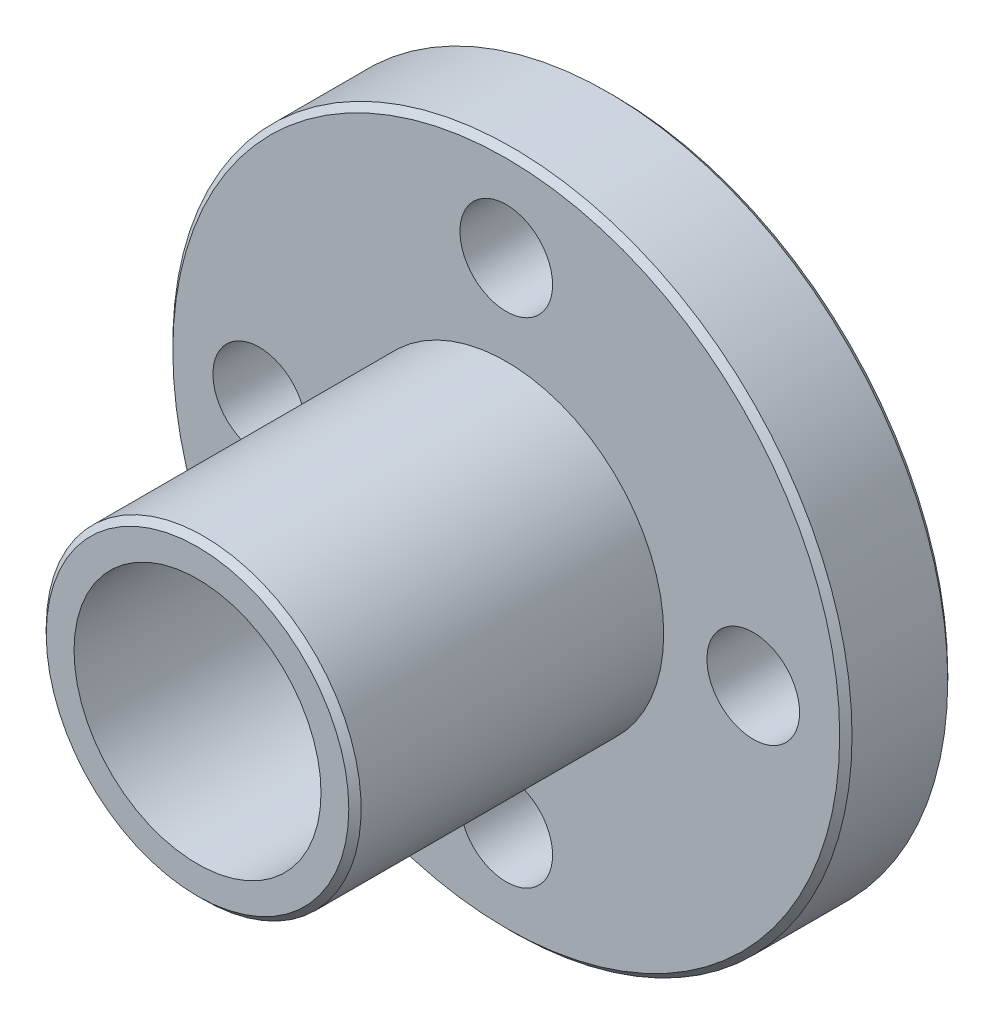
from build123d import *

# Parameters (mm, degrees)
SKETCH1_R               = 5.1
SKETCH1_R_2             = 4
BOSS_EXTRUDE1_DEPTH     = 1.5
SKETCH2_R               = 11
SKETCH2_R_2             = 4
BOSS_EXTRUDE2_DEPTH     = 3.5
SKETCH3_R               = 5.1
SKETCH3_R_2             = 4
BOSS_EXTRUDE3_DEPTH     = 15
CUT_EXTRUDE1_DEPTH      = 21.597329924
CUT_EXTRUDE1_DEPTH_BACK = 21.597329924
SKETCH4_R               = 1.5
CHAMFER1_SIZE           = 0.2


with BuildPart() as part:
    # Sketch1 → Boss-Extrude1 (new body)
    with BuildSketch(Plane.XY):
        Circle(SKETCH1_R)
        Circle(SKETCH1_R_2, mode=Mode.SUBTRACT)
    extrude(amount=BOSS_EXTRUDE1_DEPTH)

    # Sketch2 → Boss-Extrude2 (add)
    with BuildSketch(Plane.XY.offset(1.5)):
        Circle(SKETCH2_R)
        Circle(SKETCH2_R_2, mode=Mode.SUBTRACT)
    extrude(amount=BOSS_EXTRUDE2_DEPTH)

    # Sketch3 → Boss-Extrude3 (add)
    with BuildSketch(Plane(origin=(0, 0, 0), x_dir=(-1, 0, 0), z_dir=(0, 0, -1))):
        with Locations(Location((0, 0, 0), (0, 0, 180))):
            Circle(SKETCH3_R)
        Circle(SKETCH3_R_2, mode=Mode.SUBTRACT)
    extrude(amount=-BOSS_EXTRUDE3_DEPTH)

    # Sketch4 → Cut-Extrude1 (cut, two sides: drawn at the far end of the back side and taken through both)
    with BuildSketch(Plane(origin=(0, 0, 1.5), x_dir=(-1, 0, 0), z_dir=(0, 0, -1)).offset(-CUT_EXTRUDE1_DEPTH_BACK)):
        with Locations(Location((0, 8, 0), (0, 0, 180))):
            Circle(SKETCH4_R)
        with Locations(Location((8, 0, 0), (0, 0, 180))):
            Circle(SKETCH4_R)
        with Locations(Location((0, -8, 0), (0, 0, 180))):
            Circle(SKETCH4_R)
        with Locations(Location((-8, 0, 0), (0, 0, 180))):
            Circle(SKETCH4_R)
    extrude(amount=CUT_EXTRUDE1_DEPTH + CUT_EXTRUDE1_DEPTH_BACK, mode=Mode.SUBTRACT)

    # Chamfer1
    chamfer1_edges = [part.edges().sort_by_distance(p)[0] for p in [
        (-11, 0, 5),
        (-11, 0, 1.5),
        (-5.1, 0, 15),
        (-5.1, 0, 0),
    ]]
    chamfer(chamfer1_edges, length=CHAMFER1_SIZE)


solid = part.part
